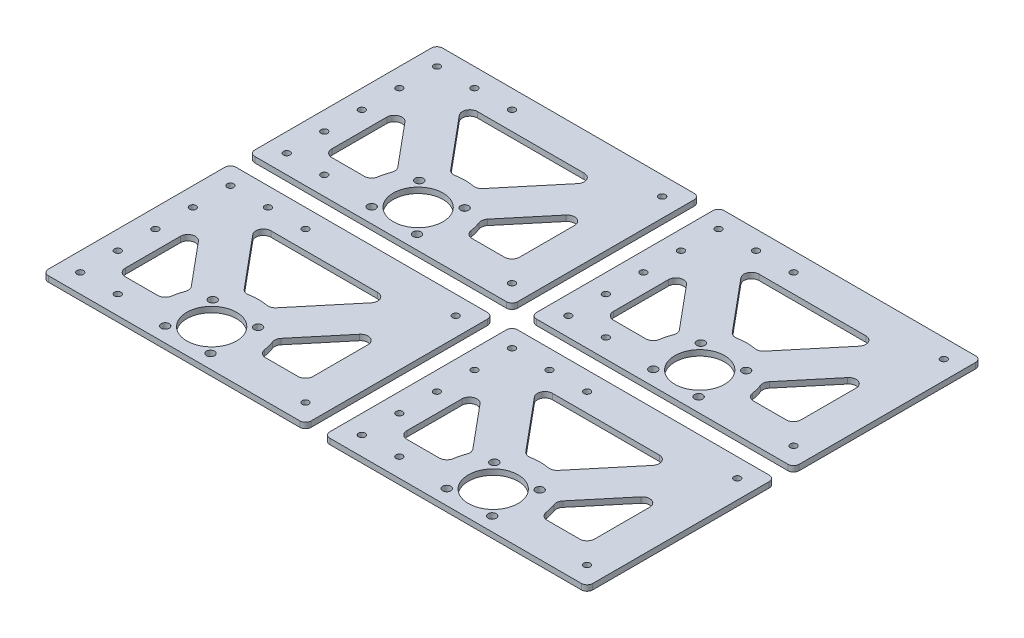
from build123d import *

# Parameters (mm, degrees)
SKETCH_1_W          = 140
SKETCH_1_H          = 100
EXTRUDE_1_DEPTH     = 3
CUT_EXTRUDE_1_REACH = 88.076
SKETCH_2_R          = 2.15
FILLET_1_R          = 4
FILLET_2_R          = 3
CUT_EXTRUDE_2_REACH = 88.076
SKETCH_3_R          = 1.75
SKETCH_4_R          = 1.75
SKETCH_4_R_2        = 2.15
SKETCH_4_R_3        = 13.25
EXTRUDE_2_DEPTH     = 3


with BuildPart() as part:
    # 草图1 → 凸台-拉伸1 (new body)
    with BuildSketch(Plane(origin=(0, 0, 0), x_dir=(1, 0, 0), z_dir=(0, 1, 0))):
        Rectangle(SKETCH_1_W, SKETCH_1_H)
    extrude(amount=EXTRUDE_1_DEPTH)

    # 草图2 → 切除-拉伸1 (cut, up to next)
    with BuildSketch(Plane(origin=(0, 3, 0), x_dir=(1, 0, 0), z_dir=(0, 1, 0)), mode=Mode.PRIVATE) as cut_extrude_1_sk1:
        with BuildLine():
            Line((-50, -30), (-25, -30))
            ThreePointArc((-25, -30), (-24.328655981, -24.245306423), (-22.350680147, -18.799683175))
            Line((-22.350680147, -18.799683175), (-50, 14.379500648))
            Line((-50, 14.379500648), (-50, -30))
        make_face()
    cut_extrude_1_tool1 = extrude(cut_extrude_1_sk1.sketch, amount=-CUT_EXTRUDE_1_REACH, mode=Mode.PRIVATE) & part.part
    # 草图2 → 切除-拉伸1 (cut, up to next)
    with BuildSketch(Plane(origin=(0, 3, 0), x_dir=(1, 0, 0), z_dir=(0, 1, 0)), mode=Mode.PRIVATE) as cut_extrude_1_sk2:
        with BuildLine():
            ThreePointArc((-6.986254555, -5.995995182), (0, -5), (6.986254555, -5.995995182))
            Line((6.986254555, -5.995995182), (36.982917207, 30))
            Line((36.982917207, 30), (-36.982917207, 30))
            Line((-36.982917207, 30), (-6.986254555, -5.995995182))
        make_face()
    cut_extrude_1_tool2 = extrude(cut_extrude_1_sk2.sketch, amount=-CUT_EXTRUDE_1_REACH, mode=Mode.PRIVATE) & part.part
    # 草图2 → 切除-拉伸1 (cut, up to next)
    with BuildSketch(Plane(origin=(0, 3, 0), x_dir=(1, 0, 0), z_dir=(0, 1, 0)), mode=Mode.PRIVATE) as cut_extrude_1_sk3:
        with BuildLine():
            ThreePointArc((22.350680147, -18.799683175), (24.328655981, -24.245306423), (25, -30))
            Line((25, -30), (50, -30))
            Line((50, -30), (50, 14.379500648))
            Line((50, 14.379500648), (22.350680147, -18.799683175))
        make_face()
    cut_extrude_1_tool3 = extrude(cut_extrude_1_sk3.sketch, amount=-CUT_EXTRUDE_1_REACH, mode=Mode.PRIVATE) & part.part
    # 草图2 → 切除-拉伸1 (cut, up to next)
    with BuildSketch(Plane(origin=(0, 3, 0), x_dir=(1, 0, 0), z_dir=(0, 1, 0)), mode=Mode.PRIVATE) as cut_extrude_1_sk4:
        with Locations(Location((12.661981395, -17.920089936, 0), (0, 0, 270))):
            Circle(SKETCH_2_R)
    cut_extrude_1_tool4 = extrude(cut_extrude_1_sk4.sketch, amount=-CUT_EXTRUDE_1_REACH, mode=Mode.PRIVATE) & part.part
    # 草图2 → 切除-拉伸1 (cut, up to next)
    with BuildSketch(Plane(origin=(0, 3, 0), x_dir=(1, 0, 0), z_dir=(0, 1, 0)), mode=Mode.PRIVATE) as cut_extrude_1_sk5:
        with Locations(Location((-12.079910064, -17.338018605, 0), (0, 0, 270))):
            Circle(SKETCH_2_R)
    cut_extrude_1_tool5 = extrude(cut_extrude_1_sk5.sketch, amount=-CUT_EXTRUDE_1_REACH, mode=Mode.PRIVATE) & part.part
    # 草图2 → 切除-拉伸1 (cut, up to next)
    with BuildSketch(Plane(origin=(0, 3, 0), x_dir=(1, 0, 0), z_dir=(0, 1, 0)), mode=Mode.PRIVATE) as cut_extrude_1_sk6:
        with Locations(Location((-12.661981395, -42.079910064, 0), (0, 0, 270))):
            Circle(SKETCH_2_R)
    cut_extrude_1_tool6 = extrude(cut_extrude_1_sk6.sketch, amount=-CUT_EXTRUDE_1_REACH, mode=Mode.PRIVATE) & part.part
    # 草图2 → 切除-拉伸1 (cut, up to next)
    with BuildSketch(Plane(origin=(0, 3, 0), x_dir=(1, 0, 0), z_dir=(0, 1, 0)), mode=Mode.PRIVATE) as cut_extrude_1_sk7:
        with Locations(Location((12.079910064, -42.661981395, 0), (0, 0, 270))):
            Circle(SKETCH_2_R)
    cut_extrude_1_tool7 = extrude(cut_extrude_1_sk7.sketch, amount=-CUT_EXTRUDE_1_REACH, mode=Mode.PRIVATE) & part.part
    # 草图2 → 切除-拉伸1 (cut, up to next)
    with BuildSketch(Plane(origin=(0, 3, 0), x_dir=(1, 0, 0), z_dir=(0, 1, 0)), mode=Mode.PRIVATE) as cut_extrude_1_sk8:
        with BuildLine():
            ThreePointArc((-13.25, -30), (0, -43.25), (13.25, -30))
            Line((13.25, -30), (-13.25, -30))
        make_face()
    cut_extrude_1_tool8 = extrude(cut_extrude_1_sk8.sketch, amount=-CUT_EXTRUDE_1_REACH, mode=Mode.PRIVATE) & part.part
    # 草图2 → 切除-拉伸1 (cut, up to next)
    with BuildSketch(Plane(origin=(0, 3, 0), x_dir=(1, 0, 0), z_dir=(0, 1, 0)), mode=Mode.PRIVATE) as cut_extrude_1_sk9:
        with BuildLine():
            Line((-13.25, -30), (13.25, -30))
            ThreePointArc((13.25, -30), (0, -16.75), (-13.25, -30))
        make_face()
    cut_extrude_1_tool9 = extrude(cut_extrude_1_sk9.sketch, amount=-CUT_EXTRUDE_1_REACH, mode=Mode.PRIVATE) & part.part
    # 草图2 → 切除-拉伸1 (cut, up to next)
    with BuildSketch(Plane(origin=(0, 3, 0), x_dir=(1, 0, 0), z_dir=(0, 1, 0)), mode=Mode.PRIVATE) as cut_extrude_1_sk10:
        with BuildLine():
            ThreePointArc((-13.25, -30), (0, -43.25), (13.25, -30))
            Line((13.25, -30), (-13.25, -30))
        make_face()
    cut_extrude_1_tool10 = extrude(cut_extrude_1_sk10.sketch, amount=-CUT_EXTRUDE_1_REACH, mode=Mode.PRIVATE) & part.part
    # 草图2 → 切除-拉伸1 (cut, up to next)
    with BuildSketch(Plane(origin=(0, 3, 0), x_dir=(1, 0, 0), z_dir=(0, 1, 0)), mode=Mode.PRIVATE) as cut_extrude_1_sk11:
        with BuildLine():
            Line((-13.25, -30), (13.25, -30))
            ThreePointArc((13.25, -30), (0, -16.75), (-13.25, -30))
        make_face()
    cut_extrude_1_tool11 = extrude(cut_extrude_1_sk11.sketch, amount=-CUT_EXTRUDE_1_REACH, mode=Mode.PRIVATE) & part.part
    add(cut_extrude_1_tool1.solids().sort_by_distance((-39.340846, 3, 14.152087))[0], mode=Mode.SUBTRACT)
    add(cut_extrude_1_tool2.solids().sort_by_distance((0, 3, -16.223295))[0], mode=Mode.SUBTRACT)
    add(cut_extrude_1_tool3.solids().sort_by_distance((39.340846, 3, 14.152087))[0], mode=Mode.SUBTRACT)
    add(cut_extrude_1_tool4.solids().sort_by_distance((12.661981, 3, 17.92009))[0], mode=Mode.SUBTRACT)
    add(cut_extrude_1_tool5.solids().sort_by_distance((-12.07991, 3, 17.338019))[0], mode=Mode.SUBTRACT)
    add(cut_extrude_1_tool6.solids().sort_by_distance((-12.661981, 3, 42.07991))[0], mode=Mode.SUBTRACT)
    add(cut_extrude_1_tool7.solids().sort_by_distance((12.07991, 3, 42.661981))[0], mode=Mode.SUBTRACT)
    add(cut_extrude_1_tool8.solids().sort_by_distance((0, 3, 35.623475))[0], mode=Mode.SUBTRACT)
    add(cut_extrude_1_tool9.solids().sort_by_distance((0, 3, 24.376525))[0], mode=Mode.SUBTRACT)
    add(cut_extrude_1_tool10.solids().sort_by_distance((0, 3, 35.623475))[0], mode=Mode.SUBTRACT)
    add(cut_extrude_1_tool11.solids().sort_by_distance((0, 3, 24.376525))[0], mode=Mode.SUBTRACT)

    # 圆角1
    fillet_1_edges = [part.edges().sort_by_distance(p)[0] for p in [
        (6.986254555, 1.5, 5.995995182),
        (-6.986254555, 1.5, 5.995995182),
        (-36.982917207, 1.5, -30),
        (36.982917207, 1.5, -30),
        (25, 1.5, 30),
        (22.350680147, 1.5, 18.799683175),
        (50, 1.5, -14.379500648),
        (50, 1.5, 30),
        (-22.350680147, 1.5, 18.799683175),
        (-25, 1.5, 30),
        (-50, 1.5, 30),
        (-50, 1.5, -14.379500648),
    ]]
    fillet(fillet_1_edges, radius=FILLET_1_R)

    # 圆角2
    fillet_2_edges = [part.edges().sort_by_distance(p)[0] for p in [
        (70, 1.5, 50),
        (-70, 1.5, 50),
        (-70, 1.5, -50),
        (70, 1.5, -50),
    ]]
    fillet(fillet_2_edges, radius=FILLET_2_R)

    # 草图3 → 切除-拉伸2 (cut, up to next)
    with BuildSketch(Plane(origin=(0, 3, 0), x_dir=(1, 0, 0), z_dir=(0, 1, 0)), mode=Mode.PRIVATE) as cut_extrude_2_sk1:
        with Locations(Location((-60, -40, 0), (0, 0, 270))):
            Circle(SKETCH_3_R)
    cut_extrude_2_tool1 = extrude(cut_extrude_2_sk1.sketch, amount=-CUT_EXTRUDE_2_REACH, mode=Mode.PRIVATE) & part.part
    # 草图3 → 切除-拉伸2 (cut, up to next)
    with BuildSketch(Plane(origin=(0, 3, 0), x_dir=(1, 0, 0), z_dir=(0, 1, 0)), mode=Mode.PRIVATE) as cut_extrude_2_sk2:
        with Locations(Location((-40, -40, 0), (0, 0, 270))):
            Circle(SKETCH_3_R)
    cut_extrude_2_tool2 = extrude(cut_extrude_2_sk2.sketch, amount=-CUT_EXTRUDE_2_REACH, mode=Mode.PRIVATE) & part.part
    # 草图3 → 切除-拉伸2 (cut, up to next)
    with BuildSketch(Plane(origin=(0, 3, 0), x_dir=(1, 0, 0), z_dir=(0, 1, 0)), mode=Mode.PRIVATE) as cut_extrude_2_sk3:
        with Locations(Location((-60, -20, 0), (0, 0, 270))):
            Circle(SKETCH_3_R)
    cut_extrude_2_tool3 = extrude(cut_extrude_2_sk3.sketch, amount=-CUT_EXTRUDE_2_REACH, mode=Mode.PRIVATE) & part.part
    # 草图3 → 切除-拉伸2 (cut, up to next)
    with BuildSketch(Plane(origin=(0, 3, 0), x_dir=(1, 0, 0), z_dir=(0, 1, 0)), mode=Mode.PRIVATE) as cut_extrude_2_sk4:
        with Locations(Location((-60, 0, 0), (0, 0, 270))):
            Circle(SKETCH_3_R)
    cut_extrude_2_tool4 = extrude(cut_extrude_2_sk4.sketch, amount=-CUT_EXTRUDE_2_REACH, mode=Mode.PRIVATE) & part.part
    # 草图3 → 切除-拉伸2 (cut, up to next)
    with BuildSketch(Plane(origin=(0, 3, 0), x_dir=(1, 0, 0), z_dir=(0, 1, 0)), mode=Mode.PRIVATE) as cut_extrude_2_sk5:
        with Locations(Location((-60, 20, 0), (0, 0, 270))):
            Circle(SKETCH_3_R)
    cut_extrude_2_tool5 = extrude(cut_extrude_2_sk5.sketch, amount=-CUT_EXTRUDE_2_REACH, mode=Mode.PRIVATE) & part.part
    # 草图3 → 切除-拉伸2 (cut, up to next)
    with BuildSketch(Plane(origin=(0, 3, 0), x_dir=(1, 0, 0), z_dir=(0, 1, 0)), mode=Mode.PRIVATE) as cut_extrude_2_sk6:
        with Locations(Location((-60, 40, 0), (0, 0, 270))):
            Circle(SKETCH_3_R)
    cut_extrude_2_tool6 = extrude(cut_extrude_2_sk6.sketch, amount=-CUT_EXTRUDE_2_REACH, mode=Mode.PRIVATE) & part.part
    # 草图3 → 切除-拉伸2 (cut, up to next)
    with BuildSketch(Plane(origin=(0, 3, 0), x_dir=(1, 0, 0), z_dir=(0, 1, 0)), mode=Mode.PRIVATE) as cut_extrude_2_sk7:
        with Locations(Location((-40, 40, 0), (0, 0, 270))):
            Circle(SKETCH_3_R)
    cut_extrude_2_tool7 = extrude(cut_extrude_2_sk7.sketch, amount=-CUT_EXTRUDE_2_REACH, mode=Mode.PRIVATE) & part.part
    # 草图3 → 切除-拉伸2 (cut, up to next)
    with BuildSketch(Plane(origin=(0, 3, 0), x_dir=(1, 0, 0), z_dir=(0, 1, 0)), mode=Mode.PRIVATE) as cut_extrude_2_sk8:
        with Locations(Location((-20, 40, 0), (0, 0, 270))):
            Circle(SKETCH_3_R)
    cut_extrude_2_tool8 = extrude(cut_extrude_2_sk8.sketch, amount=-CUT_EXTRUDE_2_REACH, mode=Mode.PRIVATE) & part.part
    # 草图3 → 切除-拉伸2 (cut, up to next)
    with BuildSketch(Plane(origin=(0, 3, 0), x_dir=(1, 0, 0), z_dir=(0, 1, 0)), mode=Mode.PRIVATE) as cut_extrude_2_sk9:
        with Locations(Location((60, -40, 0), (0, 0, 270))):
            Circle(SKETCH_3_R)
    cut_extrude_2_tool9 = extrude(cut_extrude_2_sk9.sketch, amount=-CUT_EXTRUDE_2_REACH, mode=Mode.PRIVATE) & part.part
    # 草图3 → 切除-拉伸2 (cut, up to next)
    with BuildSketch(Plane(origin=(0, 3, 0), x_dir=(1, 0, 0), z_dir=(0, 1, 0)), mode=Mode.PRIVATE) as cut_extrude_2_sk10:
        with Locations(Location((60, 40, 0), (0, 0, 270))):
            Circle(SKETCH_3_R)
    cut_extrude_2_tool10 = extrude(cut_extrude_2_sk10.sketch, amount=-CUT_EXTRUDE_2_REACH, mode=Mode.PRIVATE) & part.part
    add(cut_extrude_2_tool1.solids().sort_by_distance((-60, 3, 40))[0], mode=Mode.SUBTRACT)
    add(cut_extrude_2_tool2.solids().sort_by_distance((-40, 3, 40))[0], mode=Mode.SUBTRACT)
    add(cut_extrude_2_tool3.solids().sort_by_distance((-60, 3, 20))[0], mode=Mode.SUBTRACT)
    add(cut_extrude_2_tool4.solids().sort_by_distance((-60, 3, 0))[0], mode=Mode.SUBTRACT)
    add(cut_extrude_2_tool5.solids().sort_by_distance((-60, 3, -20))[0], mode=Mode.SUBTRACT)
    add(cut_extrude_2_tool6.solids().sort_by_distance((-60, 3, -40))[0], mode=Mode.SUBTRACT)
    add(cut_extrude_2_tool7.solids().sort_by_distance((-40, 3, -40))[0], mode=Mode.SUBTRACT)
    add(cut_extrude_2_tool8.solids().sort_by_distance((-20, 3, -40))[0], mode=Mode.SUBTRACT)
    add(cut_extrude_2_tool9.solids().sort_by_distance((60, 3, 40))[0], mode=Mode.SUBTRACT)
    add(cut_extrude_2_tool10.solids().sort_by_distance((60, 3, -40))[0], mode=Mode.SUBTRACT)

    # 草图4 → 凸台-拉伸2 (add)
    # profile 1 of 4: a face of its own
    with BuildSketch(Plane(origin=(0, 3, 0), x_dir=(1, 0, 0), z_dir=(0, 1, 0))):
        with BuildLine():
            Line((70, -47), (70, 47))
            ThreePointArc((70, 47), (69.121320344, 49.121320344), (67, 50))
            Line((67, 50), (-67, 50))
            ThreePointArc((-67, 50), (-69.121320344, 49.121320344), (-70, 47))
            Line((-70, 47), (-70, -47))
            ThreePointArc((-70, -47), (-69.121320344, -49.121320344), (-67, -50))
            Line((-67, -50), (67, -50))
            ThreePointArc((67, -50), (69.121320344, -49.121320344), (70, -47))
        make_face()
        with Locations(Location((60, -40, 0), (0, 0, 270))):
            Circle(SKETCH_4_R, mode=Mode.SUBTRACT)
        with Locations(Location((60, 40, 0), (0, 0, 270))):
            Circle(SKETCH_4_R, mode=Mode.SUBTRACT)
        with Locations(Location((-12.079910064, -17.338018605, 0), (0, 0, 270))):
            Circle(SKETCH_4_R_2, mode=Mode.SUBTRACT)
        with Locations(Location((12.661981395, -17.920089936, 0), (0, 0, 270))):
            Circle(SKETCH_4_R_2, mode=Mode.SUBTRACT)
        with Locations(Location((12.079910064, -42.661981395, 0), (0, 0, 270))):
            Circle(SKETCH_4_R_2, mode=Mode.SUBTRACT)
        with Locations(Location((0, -30, 0), (0, 0, 270))):
            Circle(SKETCH_4_R_3, mode=Mode.SUBTRACT)
        with Locations(Location((-12.661981395, -42.079910064, 0), (0, 0, 270))):
            Circle(SKETCH_4_R_2, mode=Mode.SUBTRACT)
        with Locations(Location((-40, -40, 0), (0, 0, 270))):
            Circle(SKETCH_4_R, mode=Mode.SUBTRACT)
        with Locations(Location((-60, -40, 0), (0, 0, 270))):
            Circle(SKETCH_4_R, mode=Mode.SUBTRACT)
        with Locations(Location((-60, -20, 0), (0, 0, 270))):
            Circle(SKETCH_4_R, mode=Mode.SUBTRACT)
        with Locations(Location((-60, 0, 0), (0, 0, 270))):
            Circle(SKETCH_4_R, mode=Mode.SUBTRACT)
        with Locations(Location((-60, 20, 0), (0, 0, 270))):
            Circle(SKETCH_4_R, mode=Mode.SUBTRACT)
        with Locations(Location((-60, 40, 0), (0, 0, 270))):
            Circle(SKETCH_4_R, mode=Mode.SUBTRACT)
        with Locations(Location((-40, 40, 0), (0, 0, 270))):
            Circle(SKETCH_4_R, mode=Mode.SUBTRACT)
        with Locations(Location((-20, 40, 0), (0, 0, 270))):
            Circle(SKETCH_4_R, mode=Mode.SUBTRACT)
        with BuildLine():
            Line((42.927114882, 5.892038506), (23.940880094, -16.891443239))
            ThreePointArc((23.940880094, -16.891443239), (23.065650042, -18.810007493), (23.287728631, -20.907052447))
            ThreePointArc((23.287728631, -20.907052447), (24.189600304, -23.686265992), (24.76104589, -26.551724138))
            ThreePointArc((24.76104589, -26.551724138), (26.096684575, -29.017192118), (28.722813233, -30))
            Line((28.722813233, -30), (46, -30))
            ThreePointArc((46, -30), (48.828427125, -28.828427125), (50, -26))
            Line((50, -26), (50, 3.331300907))
            ThreePointArc((50, 3.331300907), (47.361701055, 7.092387218), (42.927114882, 5.892038506))
        make_face(mode=Mode.SUBTRACT)
        with BuildLine():
            Line((-28.442750756, 30), (28.442750756, 30))
            ThreePointArc((28.442750756, 30), (32.065108441, 27.696621585), (31.515635875, 23.439262401))
            Line((31.515635875, 23.439262401), (8.576454502, -4.087755246))
            ThreePointArc((8.576454502, -4.087755246), (6.847170491, -5.294607867), (4.744456365, -5.454325558))
            ThreePointArc((4.744456365, -5.454325558), (0, -5), (-4.744456365, -5.454325558))
            ThreePointArc((-4.744456365, -5.454325558), (-6.847170491, -5.294607867), (-8.576454502, -4.087755246))
            Line((-8.576454502, -4.087755246), (-31.515635875, 23.439262401))
            ThreePointArc((-31.515635875, 23.439262401), (-32.065108441, 27.696621585), (-28.442750756, 30))
        make_face(mode=Mode.SUBTRACT)
        with BuildLine():
            Line((-50, -26), (-50, 3.331300907))
            ThreePointArc((-50, 3.331300907), (-47.361701055, 7.092387218), (-42.927114882, 5.892038506))
            Line((-42.927114882, 5.892038506), (-23.940880094, -16.891443239))
            ThreePointArc((-23.940880094, -16.891443239), (-23.065650042, -18.810007493), (-23.287728631, -20.907052447))
            ThreePointArc((-23.287728631, -20.907052447), (-24.189600304, -23.686265992), (-24.76104589, -26.551724138))
            ThreePointArc((-24.76104589, -26.551724138), (-26.096684575, -29.017192118), (-28.722813233, -30))
            Line((-28.722813233, -30), (-46, -30))
            ThreePointArc((-46, -30), (-48.828427125, -28.828427125), (-50, -26))
        make_face(mode=Mode.SUBTRACT)
    # profile 2 of 4: a face of its own
    with BuildSketch(Plane(origin=(0, 3, 0), x_dir=(1, 0, 0), z_dir=(0, 1, 0))):
        with BuildLine():
            Line((220, -47), (220, 47))
            ThreePointArc((220, 47), (219.121320344, 49.121320344), (217, 50))
            Line((217, 50), (83, 50))
            ThreePointArc((83, 50), (80.878679656, 49.121320344), (80, 47))
            Line((80, 47), (80, -47))
            ThreePointArc((80, -47), (80.878679656, -49.121320344), (83, -50))
            Line((83, -50), (217, -50))
            ThreePointArc((217, -50), (219.121320344, -49.121320344), (220, -47))
        make_face()
        with Locations(Location((210, -40, 0), (0, 0, 270))):
            Circle(SKETCH_4_R, mode=Mode.SUBTRACT)
        with Locations(Location((210, 40, 0), (0, 0, 270))):
            Circle(SKETCH_4_R, mode=Mode.SUBTRACT)
        with Locations(Location((137.920089936, -17.338018605, 0), (0, 0, 270))):
            Circle(SKETCH_4_R_2, mode=Mode.SUBTRACT)
        with Locations(Location((162.661981395, -17.920089936, 0), (0, 0, 270))):
            Circle(SKETCH_4_R_2, mode=Mode.SUBTRACT)
        with Locations(Location((162.079910064, -42.661981395, 0), (0, 0, 270))):
            Circle(SKETCH_4_R_2, mode=Mode.SUBTRACT)
        with Locations(Location((150, -30, 0), (0, 0, 270))):
            Circle(SKETCH_4_R_3, mode=Mode.SUBTRACT)
        with Locations(Location((137.338018605, -42.079910064, 0), (0, 0, 270))):
            Circle(SKETCH_4_R_2, mode=Mode.SUBTRACT)
        with Locations(Location((110, -40, 0), (0, 0, 270))):
            Circle(SKETCH_4_R, mode=Mode.SUBTRACT)
        with Locations(Location((90, -40, 0), (0, 0, 270))):
            Circle(SKETCH_4_R, mode=Mode.SUBTRACT)
        with Locations(Location((90, -20, 0), (0, 0, 270))):
            Circle(SKETCH_4_R, mode=Mode.SUBTRACT)
        with Locations(Location((90, 0, 0), (0, 0, 270))):
            Circle(SKETCH_4_R, mode=Mode.SUBTRACT)
        with Locations(Location((90, 20, 0), (0, 0, 270))):
            Circle(SKETCH_4_R, mode=Mode.SUBTRACT)
        with Locations(Location((90, 40, 0), (0, 0, 270))):
            Circle(SKETCH_4_R, mode=Mode.SUBTRACT)
        with Locations(Location((110, 40, 0), (0, 0, 270))):
            Circle(SKETCH_4_R, mode=Mode.SUBTRACT)
        with Locations(Location((130, 40, 0), (0, 0, 270))):
            Circle(SKETCH_4_R, mode=Mode.SUBTRACT)
        with BuildLine():
            Line((192.927114882, 5.892038506), (173.940880094, -16.891443239))
            ThreePointArc((173.940880094, -16.891443239), (173.065650042, -18.810007493), (173.287728631, -20.907052447))
            ThreePointArc((173.287728631, -20.907052447), (174.189600304, -23.686265992), (174.76104589, -26.551724138))
            ThreePointArc((174.76104589, -26.551724138), (176.096684575, -29.017192118), (178.722813233, -30))
            Line((178.722813233, -30), (196, -30))
            ThreePointArc((196, -30), (198.828427125, -28.828427125), (200, -26))
            Line((200, -26), (200, 3.331300907))
            ThreePointArc((200, 3.331300907), (197.361701055, 7.092387218), (192.927114882, 5.892038506))
        make_face(mode=Mode.SUBTRACT)
        with BuildLine():
            Line((121.557249244, 30), (178.442750756, 30))
            ThreePointArc((178.442750756, 30), (182.065108441, 27.696621585), (181.515635875, 23.439262401))
            Line((181.515635875, 23.439262401), (158.576454502, -4.087755246))
            ThreePointArc((158.576454502, -4.087755246), (156.847170491, -5.294607867), (154.744456365, -5.454325558))
            ThreePointArc((154.744456365, -5.454325558), (150, -5), (145.255543635, -5.454325558))
            ThreePointArc((145.255543635, -5.454325558), (143.152829509, -5.294607867), (141.423545498, -4.087755246))
            Line((141.423545498, -4.087755246), (118.484364125, 23.439262401))
            ThreePointArc((118.484364125, 23.439262401), (117.934891559, 27.696621585), (121.557249244, 30))
        make_face(mode=Mode.SUBTRACT)
        with BuildLine():
            Line((100, -26), (100, 3.331300907))
            ThreePointArc((100, 3.331300907), (102.638298945, 7.092387218), (107.072885118, 5.892038506))
            Line((107.072885118, 5.892038506), (126.059119906, -16.891443239))
            ThreePointArc((126.059119906, -16.891443239), (126.934349958, -18.810007493), (126.712271369, -20.907052447))
            ThreePointArc((126.712271369, -20.907052447), (125.810399696, -23.686265992), (125.23895411, -26.551724138))
            ThreePointArc((125.23895411, -26.551724138), (123.903315425, -29.017192118), (121.277186767, -30))
            Line((121.277186767, -30), (104, -30))
            ThreePointArc((104, -30), (101.171572875, -28.828427125), (100, -26))
        make_face(mode=Mode.SUBTRACT)
    # profile 3 of 4: a face of its own
    with BuildSketch(Plane(origin=(0, 3, 0), x_dir=(1, 0, 0), z_dir=(0, 1, 0))):
        with BuildLine():
            Line((220, 63), (220, 157))
            ThreePointArc((220, 157), (219.121320344, 159.121320344), (217, 160))
            Line((217, 160), (83, 160))
            ThreePointArc((83, 160), (80.878679656, 159.121320344), (80, 157))
            Line((80, 157), (80, 63))
            ThreePointArc((80, 63), (80.878679656, 60.878679656), (83, 60))
            Line((83, 60), (217, 60))
            ThreePointArc((217, 60), (219.121320344, 60.878679656), (220, 63))
        make_face()
        with Locations(Location((210, 70, 0), (0, 0, 270))):
            Circle(SKETCH_4_R, mode=Mode.SUBTRACT)
        with Locations(Location((210, 150, 0), (0, 0, 270))):
            Circle(SKETCH_4_R, mode=Mode.SUBTRACT)
        with Locations(Location((137.920089936, 92.661981395, 0), (0, 0, 270))):
            Circle(SKETCH_4_R_2, mode=Mode.SUBTRACT)
        with Locations(Location((162.661981395, 92.079910064, 0), (0, 0, 270))):
            Circle(SKETCH_4_R_2, mode=Mode.SUBTRACT)
        with Locations(Location((162.079910064, 67.338018605, 0), (0, 0, 270))):
            Circle(SKETCH_4_R_2, mode=Mode.SUBTRACT)
        with Locations(Location((150, 80, 0), (0, 0, 270))):
            Circle(SKETCH_4_R_3, mode=Mode.SUBTRACT)
        with Locations(Location((137.338018605, 67.920089936, 0), (0, 0, 270))):
            Circle(SKETCH_4_R_2, mode=Mode.SUBTRACT)
        with Locations(Location((110, 70, 0), (0, 0, 270))):
            Circle(SKETCH_4_R, mode=Mode.SUBTRACT)
        with Locations(Location((90, 70, 0), (0, 0, 270))):
            Circle(SKETCH_4_R, mode=Mode.SUBTRACT)
        with Locations(Location((90, 90, 0), (0, 0, 270))):
            Circle(SKETCH_4_R, mode=Mode.SUBTRACT)
        with Locations(Location((90, 110, 0), (0, 0, 270))):
            Circle(SKETCH_4_R, mode=Mode.SUBTRACT)
        with Locations(Location((90, 130, 0), (0, 0, 270))):
            Circle(SKETCH_4_R, mode=Mode.SUBTRACT)
        with Locations(Location((90, 150, 0), (0, 0, 270))):
            Circle(SKETCH_4_R, mode=Mode.SUBTRACT)
        with Locations(Location((110, 150, 0), (0, 0, 270))):
            Circle(SKETCH_4_R, mode=Mode.SUBTRACT)
        with Locations(Location((130, 150, 0), (0, 0, 270))):
            Circle(SKETCH_4_R, mode=Mode.SUBTRACT)
        with BuildLine():
            Line((192.927114882, 115.892038506), (173.940880094, 93.108556761))
            ThreePointArc((173.940880094, 93.108556761), (173.065650042, 91.189992507), (173.287728631, 89.092947553))
            ThreePointArc((173.287728631, 89.092947553), (174.189600304, 86.313734008), (174.76104589, 83.448275862))
            ThreePointArc((174.76104589, 83.448275862), (176.096684575, 80.982807882), (178.722813233, 80))
            Line((178.722813233, 80), (196, 80))
            ThreePointArc((196, 80), (198.828427125, 81.171572875), (200, 84))
            Line((200, 84), (200, 113.331300907))
            ThreePointArc((200, 113.331300907), (197.361701055, 117.092387218), (192.927114882, 115.892038506))
        make_face(mode=Mode.SUBTRACT)
        with BuildLine():
            Line((121.557249244, 140), (178.442750756, 140))
            ThreePointArc((178.442750756, 140), (182.065108441, 137.696621585), (181.515635875, 133.439262401))
            Line((181.515635875, 133.439262401), (158.576454502, 105.912244754))
            ThreePointArc((158.576454502, 105.912244754), (156.847170491, 104.705392133), (154.744456365, 104.545674442))
            ThreePointArc((154.744456365, 104.545674442), (150, 105), (145.255543635, 104.545674442))
            ThreePointArc((145.255543635, 104.545674442), (143.152829509, 104.705392133), (141.423545498, 105.912244754))
            Line((141.423545498, 105.912244754), (118.484364125, 133.439262401))
            ThreePointArc((118.484364125, 133.439262401), (117.934891559, 137.696621585), (121.557249244, 140))
        make_face(mode=Mode.SUBTRACT)
        with BuildLine():
            Line((100, 84), (100, 113.331300907))
            ThreePointArc((100, 113.331300907), (102.638298945, 117.092387218), (107.072885118, 115.892038506))
            Line((107.072885118, 115.892038506), (126.059119906, 93.108556761))
            ThreePointArc((126.059119906, 93.108556761), (126.934349958, 91.189992507), (126.712271369, 89.092947553))
            ThreePointArc((126.712271369, 89.092947553), (125.810399696, 86.313734008), (125.23895411, 83.448275862))
            ThreePointArc((125.23895411, 83.448275862), (123.903315425, 80.982807882), (121.277186767, 80))
            Line((121.277186767, 80), (104, 80))
            ThreePointArc((104, 80), (101.171572875, 81.171572875), (100, 84))
        make_face(mode=Mode.SUBTRACT)
    # profile 4 of 4: a face of its own
    with BuildSketch(Plane(origin=(0, 3, 0), x_dir=(1, 0, 0), z_dir=(0, 1, 0))):
        with BuildLine():
            Line((70, 63), (70, 157))
            ThreePointArc((70, 157), (69.121320344, 159.121320344), (67, 160))
            Line((67, 160), (-67, 160))
            ThreePointArc((-67, 160), (-69.121320344, 159.121320344), (-70, 157))
            Line((-70, 157), (-70, 63))
            ThreePointArc((-70, 63), (-69.121320344, 60.878679656), (-67, 60))
            Line((-67, 60), (67, 60))
            ThreePointArc((67, 60), (69.121320344, 60.878679656), (70, 63))
        make_face()
        with Locations(Location((60, 70, 0), (0, 0, 270))):
            Circle(SKETCH_4_R, mode=Mode.SUBTRACT)
        with Locations(Location((60, 150, 0), (0, 0, 270))):
            Circle(SKETCH_4_R, mode=Mode.SUBTRACT)
        with Locations(Location((-12.079910064, 92.661981395, 0), (0, 0, 270))):
            Circle(SKETCH_4_R_2, mode=Mode.SUBTRACT)
        with Locations(Location((12.661981395, 92.079910064, 0), (0, 0, 270))):
            Circle(SKETCH_4_R_2, mode=Mode.SUBTRACT)
        with Locations(Location((12.079910064, 67.338018605, 0), (0, 0, 270))):
            Circle(SKETCH_4_R_2, mode=Mode.SUBTRACT)
        with Locations(Location((0, 80, 0), (0, 0, 270))):
            Circle(SKETCH_4_R_3, mode=Mode.SUBTRACT)
        with Locations(Location((-12.661981395, 67.920089936, 0), (0, 0, 270))):
            Circle(SKETCH_4_R_2, mode=Mode.SUBTRACT)
        with Locations(Location((-40, 70, 0), (0, 0, 270))):
            Circle(SKETCH_4_R, mode=Mode.SUBTRACT)
        with Locations(Location((-60, 70, 0), (0, 0, 270))):
            Circle(SKETCH_4_R, mode=Mode.SUBTRACT)
        with Locations(Location((-60, 90, 0), (0, 0, 270))):
            Circle(SKETCH_4_R, mode=Mode.SUBTRACT)
        with Locations(Location((-60, 110, 0), (0, 0, 270))):
            Circle(SKETCH_4_R, mode=Mode.SUBTRACT)
        with Locations(Location((-60, 130, 0), (0, 0, 270))):
            Circle(SKETCH_4_R, mode=Mode.SUBTRACT)
        with Locations(Location((-60, 150, 0), (0, 0, 270))):
            Circle(SKETCH_4_R, mode=Mode.SUBTRACT)
        with Locations(Location((-40, 150, 0), (0, 0, 270))):
            Circle(SKETCH_4_R, mode=Mode.SUBTRACT)
        with Locations(Location((-20, 150, 0), (0, 0, 270))):
            Circle(SKETCH_4_R, mode=Mode.SUBTRACT)
        with BuildLine():
            Line((42.927114882, 115.892038506), (23.940880094, 93.108556761))
            ThreePointArc((23.940880094, 93.108556761), (23.065650042, 91.189992507), (23.287728631, 89.092947553))
            ThreePointArc((23.287728631, 89.092947553), (24.189600304, 86.313734008), (24.76104589, 83.448275862))
            ThreePointArc((24.76104589, 83.448275862), (26.096684575, 80.982807882), (28.722813233, 80))
            Line((28.722813233, 80), (46, 80))
            ThreePointArc((46, 80), (48.828427125, 81.171572875), (50, 84))
            Line((50, 84), (50, 113.331300907))
            ThreePointArc((50, 113.331300907), (47.361701055, 117.092387218), (42.927114882, 115.892038506))
        make_face(mode=Mode.SUBTRACT)
        with BuildLine():
            Line((-28.442750756, 140), (28.442750756, 140))
            ThreePointArc((28.442750756, 140), (32.065108441, 137.696621585), (31.515635875, 133.439262401))
            Line((31.515635875, 133.439262401), (8.576454502, 105.912244754))
            ThreePointArc((8.576454502, 105.912244754), (6.847170491, 104.705392133), (4.744456365, 104.545674442))
            ThreePointArc((4.744456365, 104.545674442), (0, 105), (-4.744456365, 104.545674442))
            ThreePointArc((-4.744456365, 104.545674442), (-6.847170491, 104.705392133), (-8.576454502, 105.912244754))
            Line((-8.576454502, 105.912244754), (-31.515635875, 133.439262401))
            ThreePointArc((-31.515635875, 133.439262401), (-32.065108441, 137.696621585), (-28.442750756, 140))
        make_face(mode=Mode.SUBTRACT)
        with BuildLine():
            Line((-50, 84), (-50, 113.331300907))
            ThreePointArc((-50, 113.331300907), (-47.361701055, 117.092387218), (-42.927114882, 115.892038506))
            Line((-42.927114882, 115.892038506), (-23.940880094, 93.108556761))
            ThreePointArc((-23.940880094, 93.108556761), (-23.065650042, 91.189992507), (-23.287728631, 89.092947553))
            ThreePointArc((-23.287728631, 89.092947553), (-24.189600304, 86.313734008), (-24.76104589, 83.448275862))
            ThreePointArc((-24.76104589, 83.448275862), (-26.096684575, 80.982807882), (-28.722813233, 80))
            Line((-28.722813233, 80), (-46, 80))
            ThreePointArc((-46, 80), (-48.828427125, 81.171572875), (-50, 84))
        make_face(mode=Mode.SUBTRACT)
    extrude(amount=-EXTRUDE_2_DEPTH)


with BuildPart() as extrude_2_piece_1:
    # of the separate pieces the step leaves, piece 1, a body of its own (extrude_2_pieces)
    add(part.part.solids().sort_by_distance((-67, 3, -60))[0])


with BuildPart() as extrude_2_piece_2:
    # of the separate pieces the step leaves, piece 2, a body of its own (extrude_2_pieces)
    add(part.part.solids().sort_by_distance((217, 3, 50))[0])


with BuildPart() as extrude_2_piece_3:
    # of the separate pieces the step leaves, piece 3, a body of its own (extrude_2_pieces)
    add(part.part.solids().sort_by_distance((217, 3, -60))[0])


with BuildPart() as extrude_2_piece_4:
    # of the separate pieces the step leaves, piece 4, a body of its own (extrude_2_pieces)
    add(part.part.solids().sort_by_distance((-67, 0, 50))[0])


solid = Compound([extrude_2_piece_1.part, extrude_2_piece_2.part, extrude_2_piece_3.part, extrude_2_piece_4.part])
